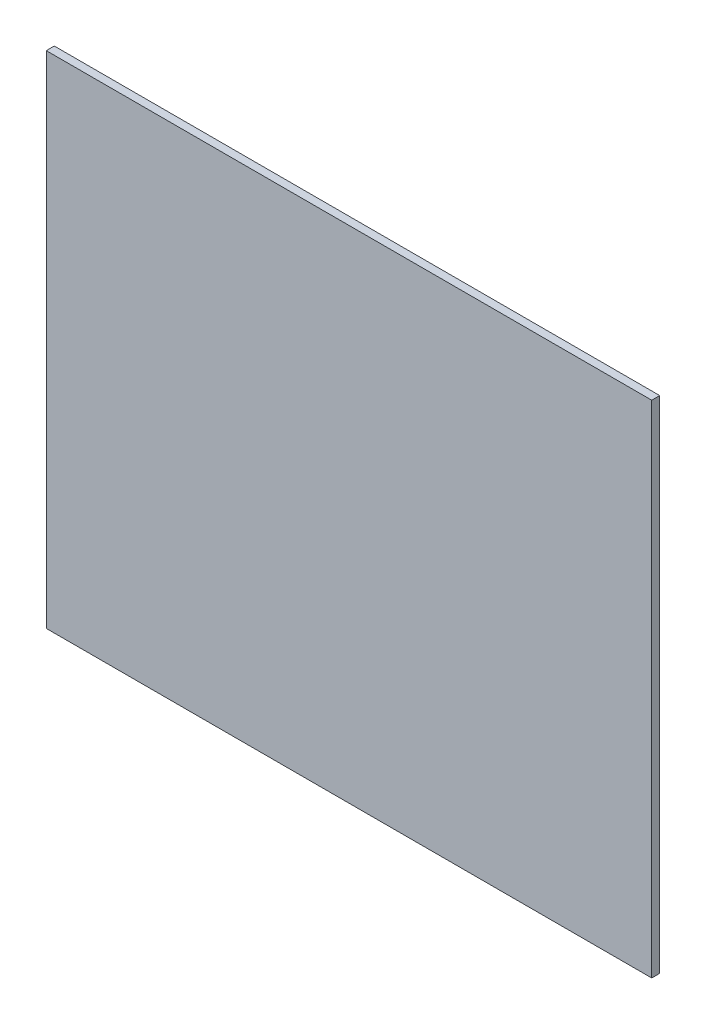
from build123d import *

# Parameters (mm, degrees)
SKETCH1_W           = 60.5
SKETCH1_H           = 50
BOSS_EXTRUDE1_DEPTH = 0.8


with BuildPart() as part:
    # Sketch1 → Boss-Extrude1 (new body)
    with BuildSketch(Plane.XY):
        with Locations((-18.458808224, -8.5)):
            Rectangle(SKETCH1_W, SKETCH1_H)
    extrude(amount=BOSS_EXTRUDE1_DEPTH)


solid = part.part
